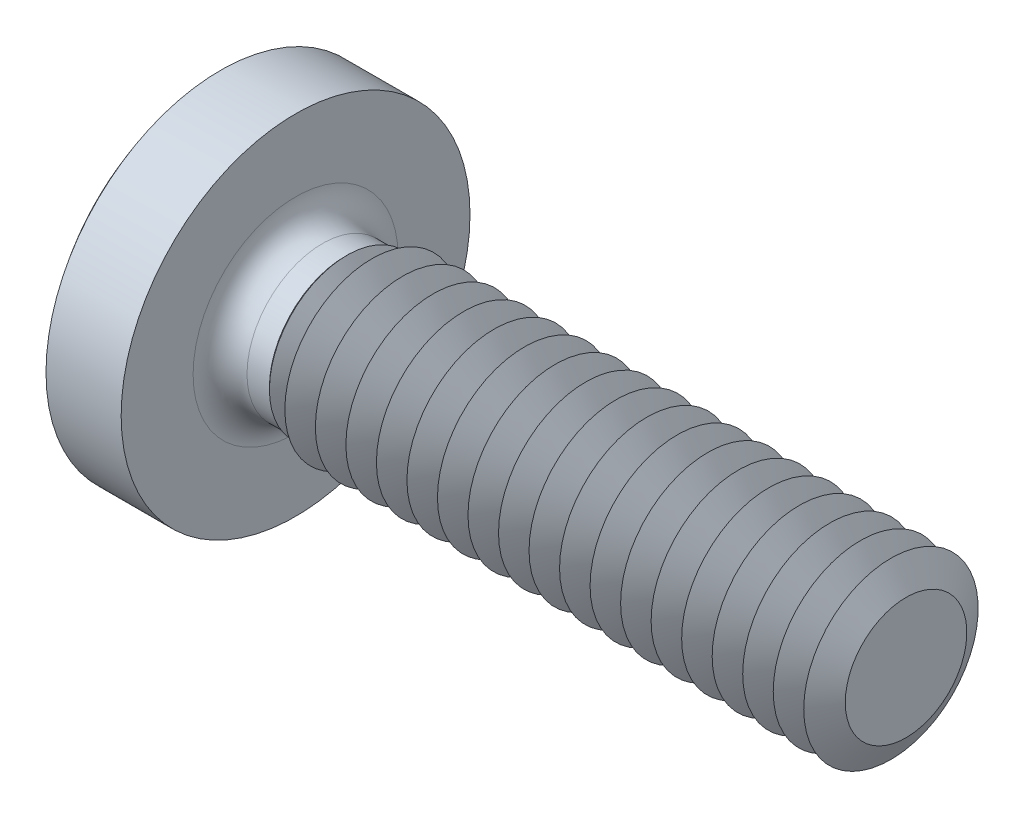
from build123d import *

# Parameters (mm, degrees)
PATTERN_LINEAR_1_COUNT = 19
PATTERN_LINEAR_1_PITCH = 0.7


with BuildPart() as part:
    # 草图2 → Revolve 709 (revolve)
    with BuildSketch(Plane.XY, mode=Mode.PRIVATE) as revolve_709_sk:
        with BuildLine():
            Line((0, 0), (17.1, 0))
            Line((17.1, 0), (17.1, 2))
            Line((17.1, 2), (4.5, 2))
            Line((4.5, 2), (4.232, 1.732))
            Line((4.232, 1.732), (3.718, 1.732))
            ThreePointArc((3.718, 1.732), (3.281008009, 1.913008009), (3.1, 2.35))
            Line((3.1, 2.35), (3.1, 4))
            Line((3.1, 4), (1.376524617, 4))
            ThreePointArc((1.376524617, 4), (0.353757652, 2.115113473), (0, 0))
        make_face()
    revolve(revolve_709_sk.sketch.rotate(Axis((-1.331757704, 0, 0), (1, 0, 0)), 90), axis=Axis((-1.331757704, 0, 0), (1, 0, 0)))

    # 草图3 → 切除-旋转1 (revolve, cut)
    with BuildSketch(Plane.XY, mode=Mode.PRIVATE) as cut_revolve_1_sk:
        Polygon((16.753791204, 2), (17.453791204, 2), (17.1, 1.3938), align=None)
    cut_revolve_1 = revolve(cut_revolve_1_sk.sketch.rotate(Axis((-0.242766179, 0, 0), (1, 0, 0)), 90), axis=Axis((-0.242766179, 0, 0), (1, 0, 0)), mode=Mode.SUBTRACT)

    # 阵列(线性)1: 切除-旋转1 ×19
    with Locations(*[(-i * PATTERN_LINEAR_1_PITCH, 0, 0) for i in range(1, PATTERN_LINEAR_1_COUNT)]):
        add(cut_revolve_1, mode=Mode.SUBTRACT)

    # 草图5 → 切除-放样1 section 0
    with BuildSketch(Plane(origin=(0, 0, 0), x_dir=(0, 0, -1), z_dir=(1, 0, 0)), mode=Mode.PRIVATE) as loft_1_s0:
        with BuildLine():
            Line((0.35, 2.2), (-0.35, 2.2))
            Line((-0.35, 2.2), (-0.35, -2.2))
            Line((-0.35, -2.2), (0.35, -2.2))
            Line((0.35, -2.2), (0.35, 2.2))
        make_face()
    loft_1 = loft([Vertex(2.4, 0, 0), loft_1_s0.sketch], mode=Mode.SUBTRACT)

    # 镜向1: 切除-放样1 across plane
    add(loft_1.mirror(Plane(origin=(0, 0, 0), x_dir=(0, 0.7071067811865462, 0.7071067811865488), z_dir=(0, -0.7071067811865488, 0.7071067811865462))), mode=Mode.SUBTRACT)


solid = part.part
